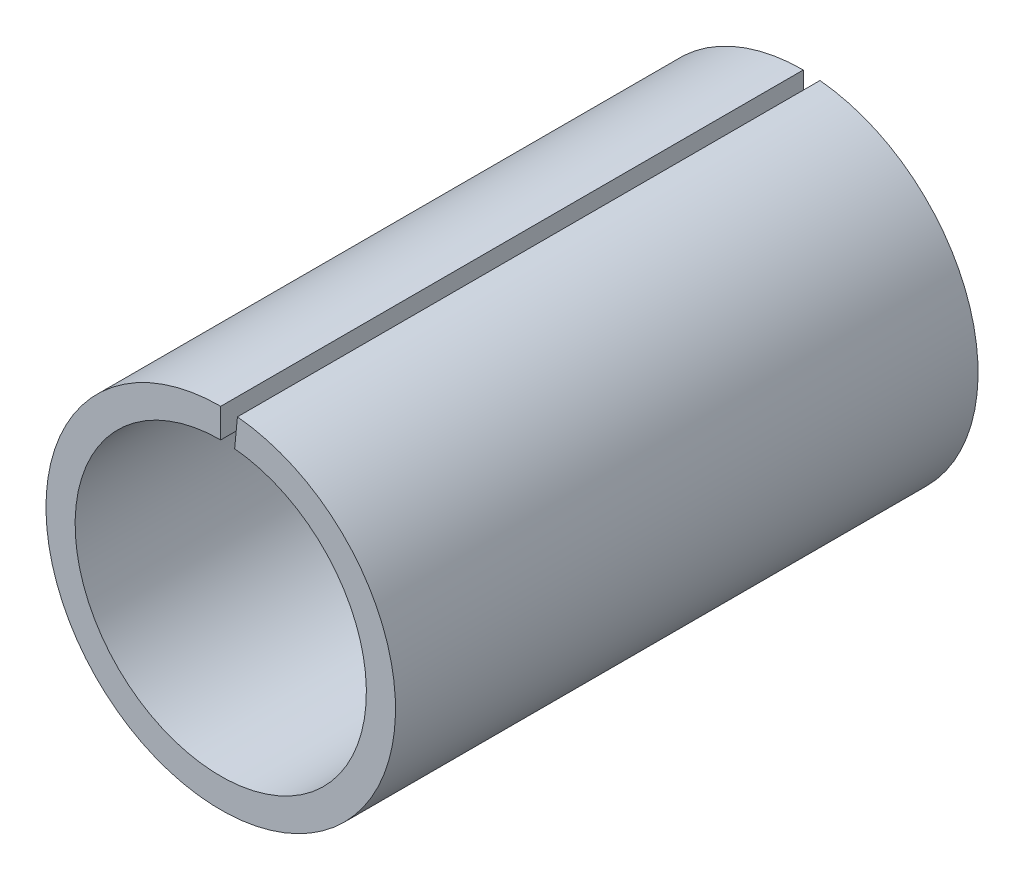
from build123d import *

# Parameters (mm, degrees)
SKETCH_1_R          = 6
SKETCH_1_R_2        = 5
EXTRUDE_1_DEPTH     = 20
CUT_EXTRUDE_1_DEPTH = 100


with BuildPart() as part:
    # 草图1 → 凸台-拉伸1 (new body)
    with BuildSketch(Plane.XY):
        Circle(SKETCH_1_R)
        Circle(SKETCH_1_R_2, mode=Mode.SUBTRACT)
    extrude(amount=EXTRUDE_1_DEPTH)

    # 草图2 → 切除-拉伸1 (cut)
    with BuildSketch(Plane.XY.offset(20)):
        Polygon((0, 0), (0, 12.680870074), (1.216603418, 12.680870074), align=None)
    extrude(amount=-CUT_EXTRUDE_1_DEPTH, mode=Mode.SUBTRACT)


solid = part.part
